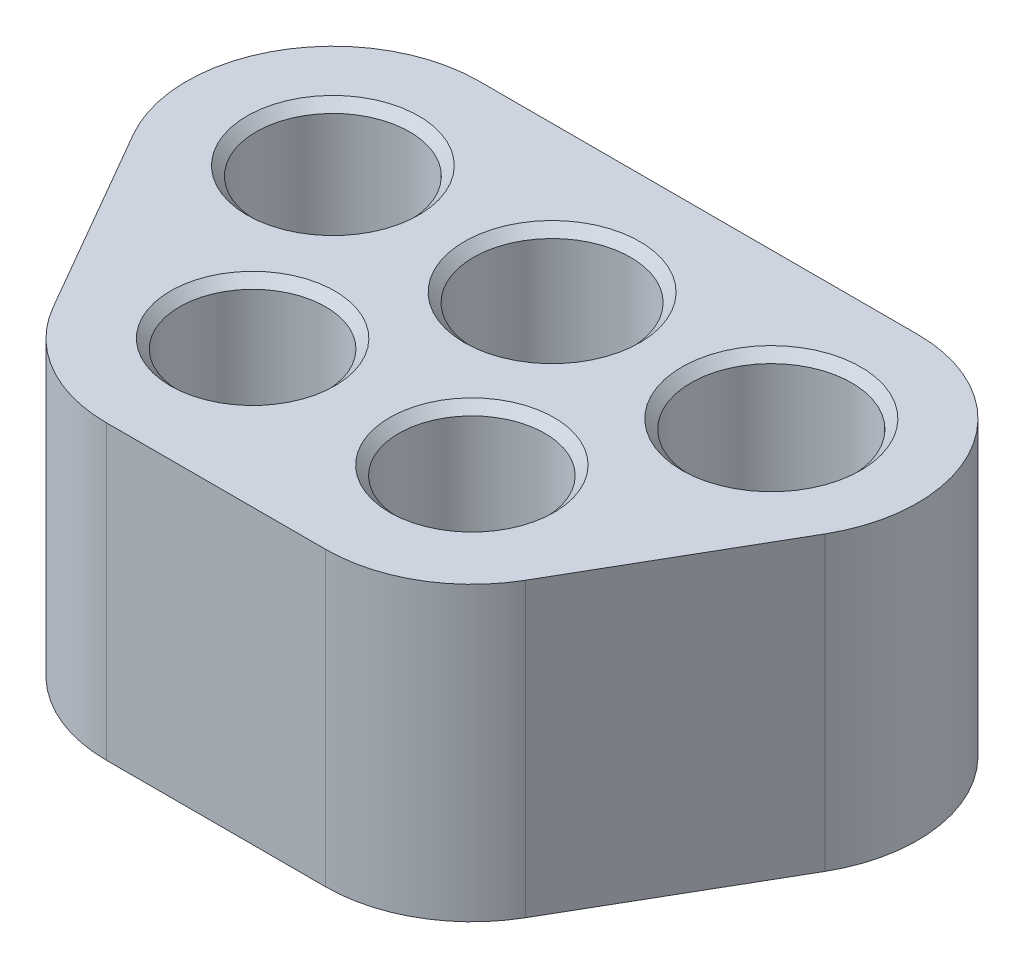
from build123d import *

# Parameters (mm, degrees)
SKETCH1_R           = 2.1
SKETCH1_R_2         = 2.15
SKETCH1_R_3         = 2.2
SKETCH1_R_4         = 2
BOSS_EXTRUDE1_DEPTH = 8
FILLET1_R           = 4
CHAMFER1_SIZE       = 0.25


with BuildPart() as part:
    # Sketch1 → Boss-Extrude1 (new body)
    with BuildSketch(Plane(origin=(0, 0, 0), x_dir=(1, 0, 0), z_dir=(0, 1, 0))):
        Polygon((-6.92820323, 4), (0.690598923, -9.196152423), (11.309401077, -9.196152423), (18.92820323, 4), align=None)
        with Locations(Location((0, 0, 0), (0, 0, 270))):
            Circle(SKETCH1_R, mode=Mode.SUBTRACT)
        with Locations(Location((6, 0, 0), (0, 0, 270))):
            Circle(SKETCH1_R_2, mode=Mode.SUBTRACT)
        with Locations(Location((12, 0, 0), (0, 0, 270))):
            Circle(SKETCH1_R_3, mode=Mode.SUBTRACT)
        with Locations(Location((3, -5.196152423, 0), (0, 0, 270))):
            Circle(SKETCH1_R_4, mode=Mode.SUBTRACT)
        with Locations(Location((9, -5.196152423, 0), (0, 0, 270))):
            Circle(SKETCH1_R_4, mode=Mode.SUBTRACT)
    extrude(amount=BOSS_EXTRUDE1_DEPTH)

    # Fillet1
    fillet1_edges = [part.edges().sort_by_distance(p)[0] for p in [
        (18.92820323, 4, -4),
        (11.309401077, 4, 9.196152423),
        (0.690598923, 4, 9.196152423),
        (-6.92820323, 4, -4),
    ]]
    fillet(fillet1_edges, radius=FILLET1_R)

    # Chamfer1
    chamfer1_edges = [part.edges().sort_by_distance(p)[0] for p in [
        (0, 8, -2.1),
        (6, 8, -2.15),
        (12, 8, -2.2),
        (9, 8, 3.196152423),
        (3, 8, 3.196152423),
    ]]
    chamfer(chamfer1_edges, length=CHAMFER1_SIZE)


solid = part.part
